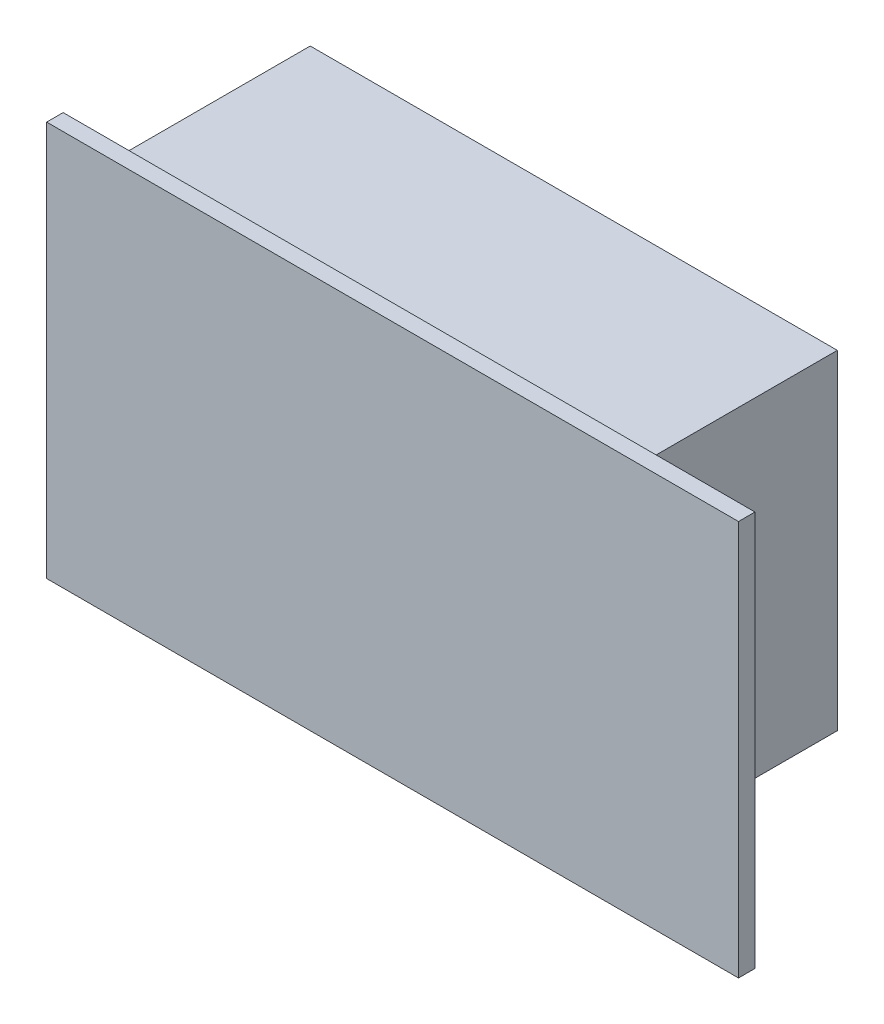
from build123d import *

# Parameters (mm, degrees)
ESQUISSE2_W             = 4.2
ESQUISSE2_H             = 2.4
BOSS_EXTRU_1_DEPTH      = 0.1
ESQUISSE3_W             = 3.2
ESQUISSE3_H             = 2
BOSS_EXTRU_2_DEPTH      = 1.3
ESQUISSE4_W             = 3
ESQUISSE4_H             = 1.8
ENL_V_MAT_EXTRU_1_DEPTH = 0.01


with BuildPart() as part:
    # Esquisse2 → Boss.-Extru.1 (new body)
    with BuildSketch(Plane.XY):
        with Locations((2.1, 1.2)):
            Rectangle(ESQUISSE2_W, ESQUISSE2_H)
    extrude(amount=BOSS_EXTRU_1_DEPTH)

    # Esquisse3 → Boss.-Extru.2 (add)
    with BuildSketch(Plane(origin=(0, 0, 0), x_dir=(-1, 0, 0), z_dir=(0, 0, -1))):
        with Locations((-1.8, 1.2)):
            Rectangle(ESQUISSE3_W, ESQUISSE3_H)
    extrude(amount=BOSS_EXTRU_2_DEPTH)

    # Esquisse4 → Enlèv. mat.-Extru.1 (cut)
    with BuildSketch(Plane(origin=(0, 0, -1.3), x_dir=(-1, 0, 0), z_dir=(0, 0, -1))):
        with Locations((-1.8, 1.2)):
            Rectangle(ESQUISSE4_W, ESQUISSE4_H)
    extrude(amount=-ENL_V_MAT_EXTRU_1_DEPTH, mode=Mode.SUBTRACT)


solid = part.part
